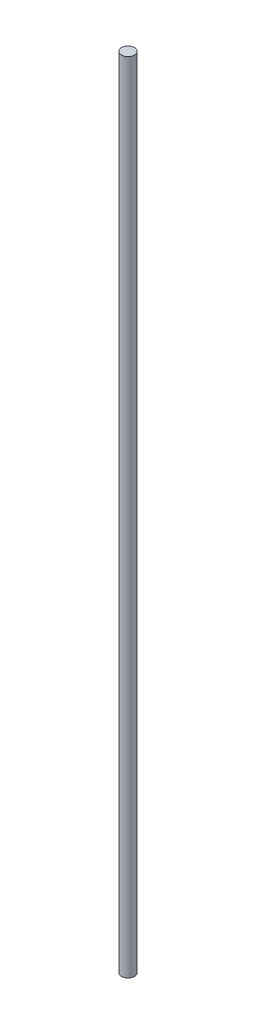
from build123d import *

# Parameters (mm, degrees)
SKETCH1_R           = 4
BOSS_EXTRUDE1_DEPTH = 489.05


with BuildPart() as part:
    # Sketch1 → Boss-Extrude1 (new body)
    with BuildSketch(Plane(origin=(0, 0, 0), x_dir=(1, 0, 0), z_dir=(0, 1, 0))):
        with Locations(Location((0, 0, 0), (0, 0, 270))):
            Circle(SKETCH1_R)
    extrude(amount=BOSS_EXTRUDE1_DEPTH)


solid = part.part
